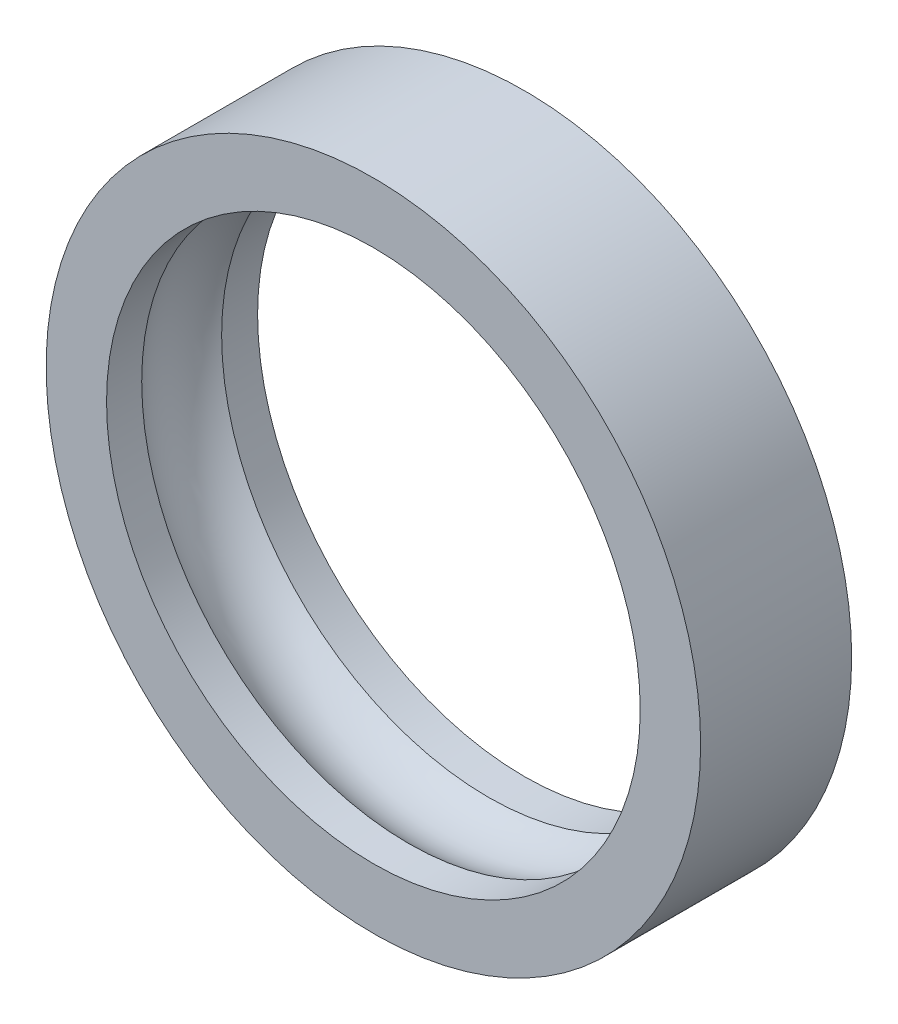
from build123d import *


with BuildPart() as part:
    # Sketch1 → Revolve6 (revolve)
    with BuildSketch(Plane(origin=(0, 0, 0), x_dir=(0, 0, -1), z_dir=(1, 0, 0)), mode=Mode.PRIVATE) as revolve6_sk:
        with BuildLine():
            Line((15, 53), (15, 65))
            Line((15, 65), (-15, 65))
            Line((-15, 65), (-15, 53))
            Line((-15, 53), (-8.018550142, 53))
            ThreePointArc((-8.018550142, 53), (-0.081296209, 56), (7.855957724, 53))
            Line((7.855957724, 53), (15, 53))
        make_face()
    revolve(revolve6_sk.sketch.rotate(Axis((0, 0, 0), (0, 0, -1)), 90), axis=Axis((0, 0, 0), (0, 0, -1)))


solid = part.part
